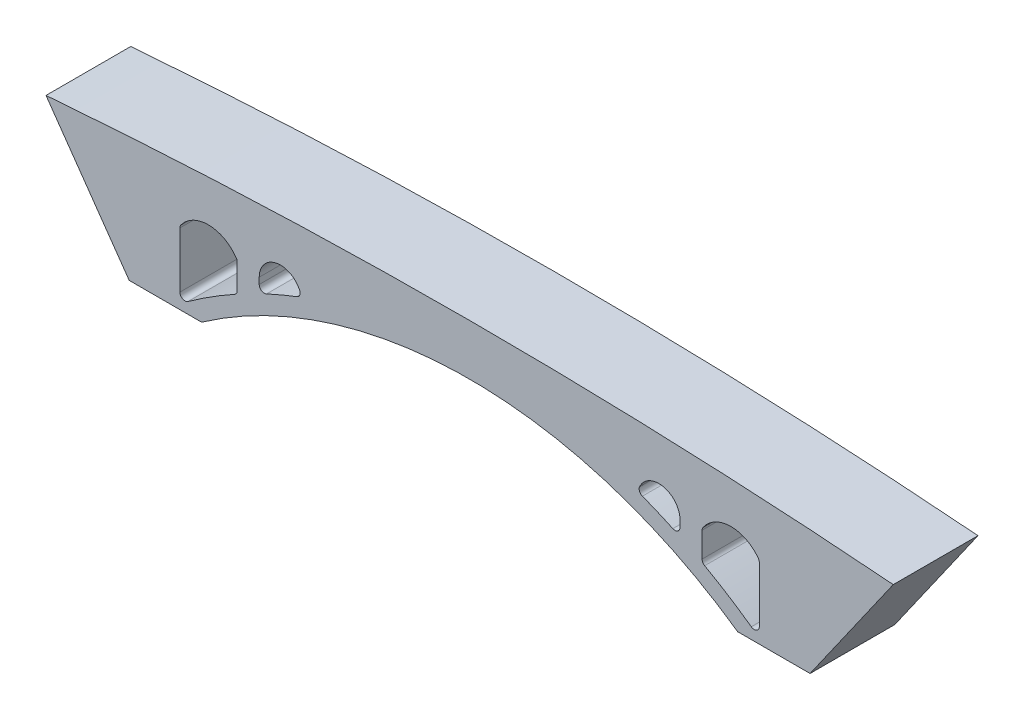
from build123d import *

# Parameters (mm, degrees)
EXTRUDE_1_DEPTH = 50
FILLET_1_R      = 3


with BuildPart() as part:
    # 草图2 → 凸台-拉伸1 (new body)
    with BuildSketch(Plane.XY):
        with BuildLine():
            Line((-200.898692044, 0), (-175, 0))
            ThreePointArc((-175, 0), (-172.9897341, 1.547802854), (-170.96577925, 3.077662138))
            Line((-170.96577925, 3.077662138), (-170.96577925, 42.722835601))
            ThreePointArc((-170.96577925, 42.722835601), (-153.932084993, 51.775484786), (-137.172282431, 42.225290265))
            Line((-137.172282431, 42.225290265), (-137.172282431, 24.846777263))
            ThreePointArc((-137.172282431, 24.846777263), (-130.71526297, 28.281929654), (-124.172282431, 31.55038157))
            Line((-124.172282431, 31.55038157), (-124.172282431, 40.001262339))
            ThreePointArc((-124.172282431, 40.001262339), (-112.742884956, 52.455330358), (-99.355672794, 42.134599408))
            ThreePointArc((-99.355672794, 42.134599408), (0, 60), (99.355672794, 42.134599408))
            ThreePointArc((99.355672794, 42.134599408), (112.742884956, 52.455330358), (124.172282431, 40.001262339))
            Line((124.172282431, 40.001262339), (124.172282431, 31.55038157))
            ThreePointArc((124.172282431, 31.55038157), (130.71526297, 28.281929654), (137.172282431, 24.846777263))
            Line((137.172282431, 24.846777263), (137.172282431, 42.225290265))
            ThreePointArc((137.172282431, 42.225290265), (153.932084993, 51.775484786), (170.96577925, 42.722835601))
            Line((170.96577925, 42.722835601), (170.96577925, 3.077662138))
            ThreePointArc((170.96577925, 3.077662138), (172.9897341, 1.547802854), (175, 0))
            Line((175, 0), (200.898692044, 0))
            Line((200.898692044, 0), (250, 70))
            ThreePointArc((250, 70), (0, 80), (-250, 70))
            Line((-250, 70), (-200.898692044, 0))
        make_face()
        with BuildLine():
            Line((-175, 0), (-158.179750074, 0))
            ThreePointArc((-158.179750074, 0), (0, 50), (158.179750074, 0))
            Line((158.179750074, 0), (175, 0))
            ThreePointArc((175, 0), (0, 60), (-175, 0))
        make_face()
    extrude(amount=EXTRUDE_1_DEPTH)

    # 圆角1
    fillet_1_edges = [part.edges().sort_by_distance(p)[0] for p in [
        (137.172282431, 24.846777263, 25),
        (170.96577925, 3.077662138, 25),
        (170.96577925, 42.722835601, 25),
        (137.172282431, 42.225290265, 25),
        (124.172282431, 31.55038157, 25),
        (99.355672794, 42.134599408, 25),
        (-99.355672794, 42.134599408, 25),
        (-124.172282431, 31.55038157, 25),
        (-137.172282431, 24.846777263, 25),
        (-137.172282431, 42.225290265, 25),
        (-170.96577925, 42.722835601, 25),
        (-170.96577925, 3.077662138, 25),
    ]]
    fillet(fillet_1_edges, radius=FILLET_1_R)


solid = part.part
